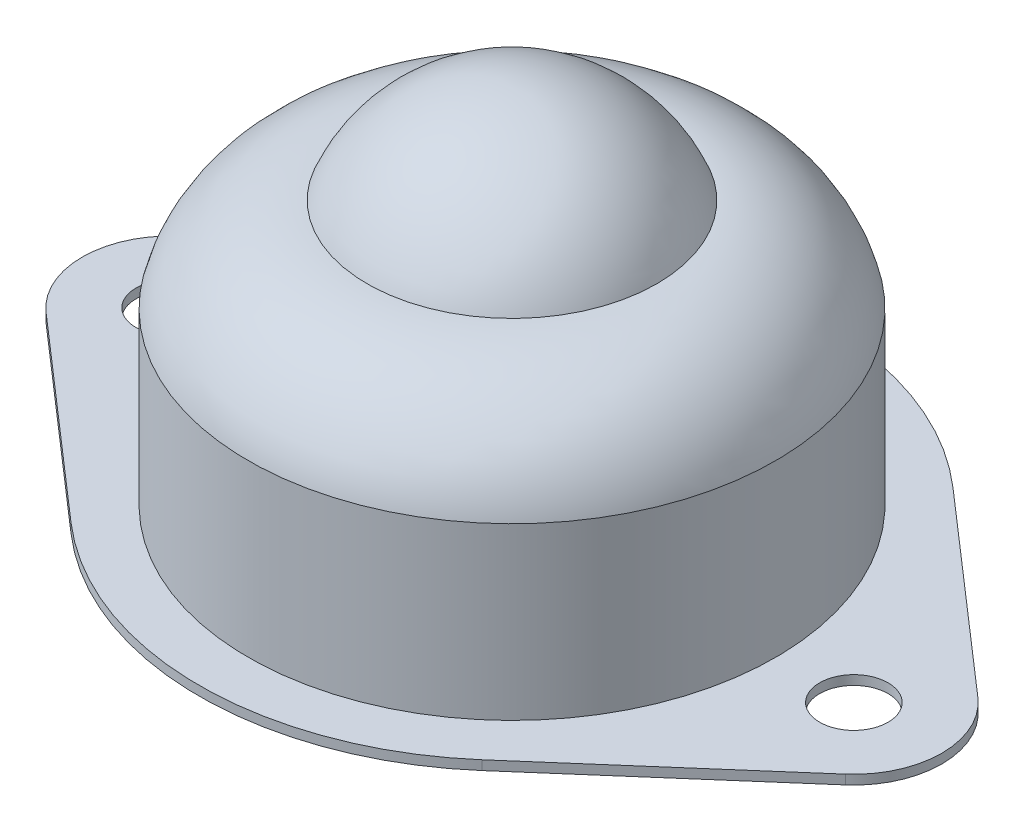
from build123d import *

# Parameters (mm, degrees)
SKETCH1_R           = 2.778125
BOSS_EXTRUDE1_DEPTH = 0.762


with BuildPart() as part:
    # Sketch1 → Boss-Extrude1 (new body)
    with BuildSketch(Plane(origin=(0, 0, 0), x_dir=(1, 0, 0), z_dir=(0, 1, 0))):
        with BuildLine():
            Line((-16.691428571, 19.145657791), (-32.475714286, 5.384716254))
            ThreePointArc((-32.475714286, 5.384716254), (-34.925, 0), (-32.475714286, -5.384716254))
            Line((-32.475714286, -5.384716254), (-16.691428571, -19.145657791))
            ThreePointArc((-16.691428571, -19.145657791), (0, -25.4), (16.691428571, -19.145657791))
            Line((16.691428571, -19.145657791), (32.475714286, -5.384716254))
            ThreePointArc((32.475714286, -5.384716254), (34.925, 0), (32.475714286, 5.384716254))
            Line((32.475714286, 5.384716254), (16.691428571, 19.145657791))
            ThreePointArc((16.691428571, 19.145657791), (0, 25.4), (-16.691428571, 19.145657791))
        make_face()
        with Locations(Location((-27.78125, 0, 0), (0, 0, 90))):
            Circle(SKETCH1_R, mode=Mode.SUBTRACT)
        with Locations(Location((27.78125, 0, 0), (0, 0, 90))):
            Circle(SKETCH1_R, mode=Mode.SUBTRACT)
    extrude(amount=BOSS_EXTRUDE1_DEPTH)

    # Sketch2 → Revolve1 (revolve)
    with BuildSketch(Plane.XY, mode=Mode.PRIVATE) as revolve1_sk:
        with BuildLine():
            Line((21.43125, 14.605), (21.43125, 0))
            Line((21.43125, 0), (0, 0))
            Line((0, 0), (0, 30.1625))
            ThreePointArc((0, 30.1625), (7.099515829, 27.992783709), (11.773215098, 22.225))
            ThreePointArc((11.773215098, 22.225), (17.924272694, 20.090631215), (21.43125, 14.605))
        make_face()
    revolve(revolve1_sk.sketch.rotate(Axis((0, 0, 0), (0, 1, 0)), 90), axis=Axis((0, 0, 0), (0, 1, 0)))


solid = part.part
